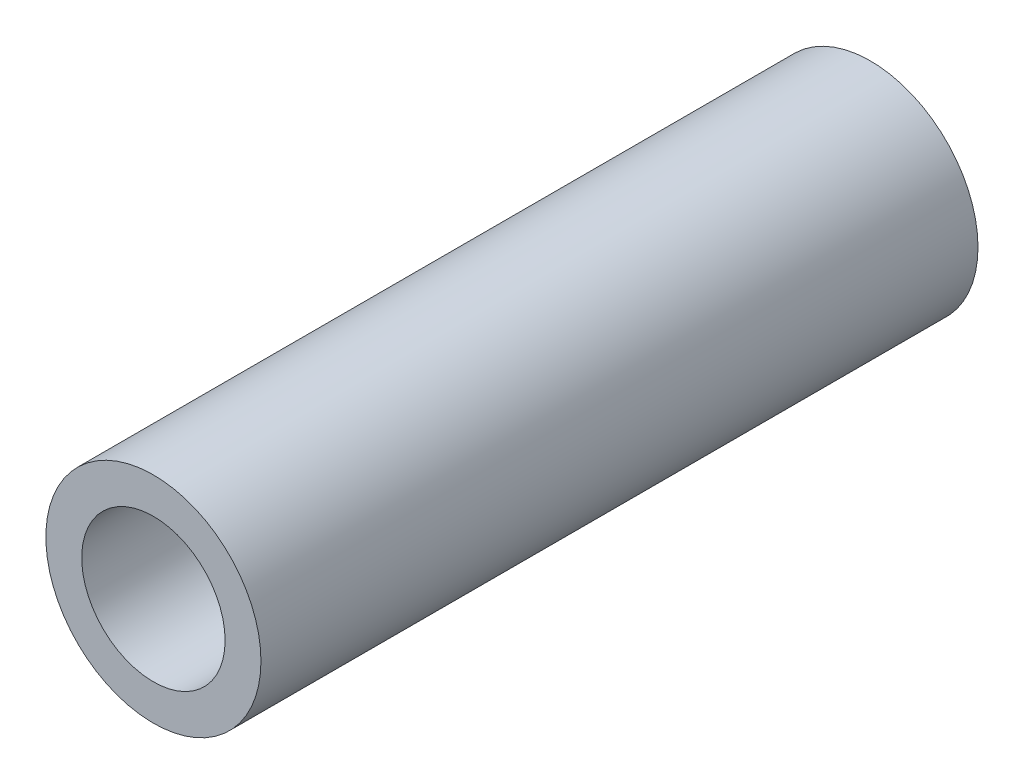
from build123d import *

# Parameters (mm, degrees)
SKETCH_1_R      = 3
SKETCH_1_R_2    = 2
EXTRUDE_1_DEPTH = 20


with BuildPart() as part:
    # ｽｹｯﾁ1 → ﾎﾞｽ - 押し出し1 (new body)
    with BuildSketch(Plane.XY):
        Circle(SKETCH_1_R)
        Circle(SKETCH_1_R_2, mode=Mode.SUBTRACT)
    extrude(amount=EXTRUDE_1_DEPTH)


solid = part.part
